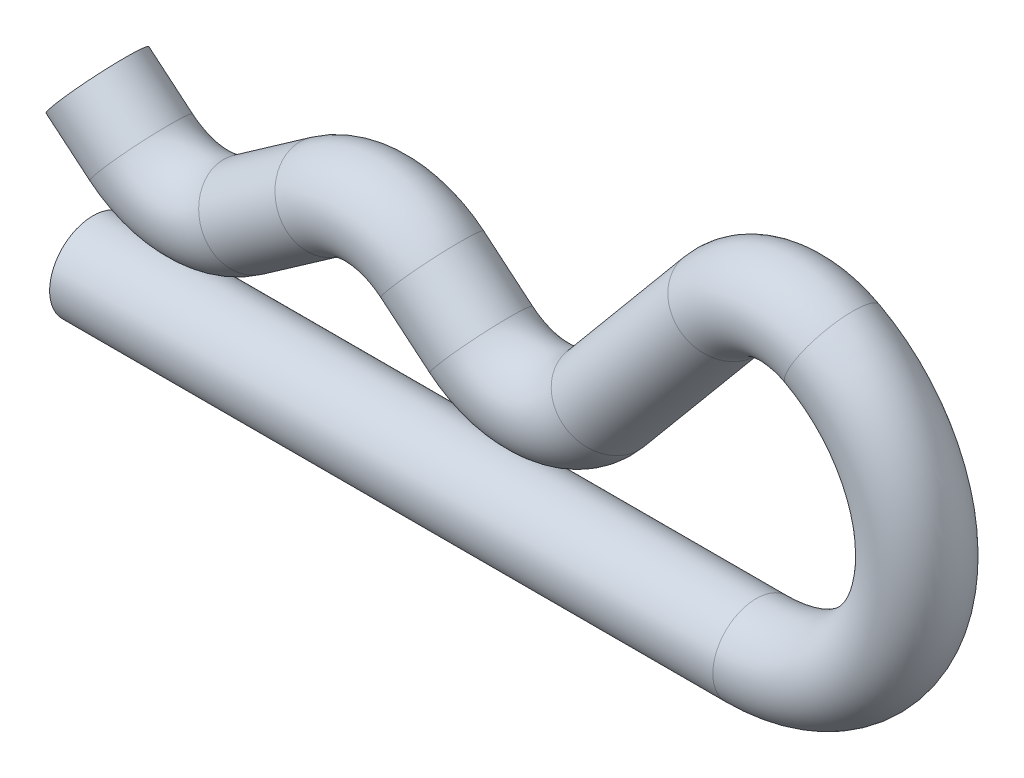
from build123d import *

# Parameters (mm, degrees)
SKETCH2_R = 4.9


with BuildPart() as part:
    # Sweep1: sweep along a path in Sketch1
    with BuildLine(Plane.XY) as sweep1_path:
        Line((0, 0), (75, 0))
        ThreePointArc((75, 0), (92.622639779, 13.738596191), (83.598269269, 34.180396379))
        ThreePointArc((83.598269269, 34.180396379), (76.966606242, 35.188525158), (71.189841712, 31.779086834))
        Line((71.189841712, 31.779086834), (58.000779789, 15.97968974))
        ThreePointArc((58.000779789, 15.97968974), (51.220886684, 12.428395153), (43.915633809, 14.711359059))
        Line((43.915633809, 14.711359059), (38.376494478, 19.33533624))
        ThreePointArc((38.376494478, 19.33533624), (32.391635437, 21.649624212), (26.232382515, 19.8501604))
        Line((26.232382515, 19.8501604), (17.603773383, 13.808437509))
        ThreePointArc((17.603773383, 13.808437509), (11.444520462, 12.008973698), (5.45966142, 14.32326167))
        Line((5.45966142, 14.32326167), (0.509042861, 18.455951945))
    # Sketch2 → Sweep1 (sweep)
    with BuildSketch(Plane(origin=(0, 0, 0), x_dir=(0, 0, -1), z_dir=(1, 0, 0))):
        Circle(SKETCH2_R)
    sweep(path=sweep1_path.line)


solid = part.part
